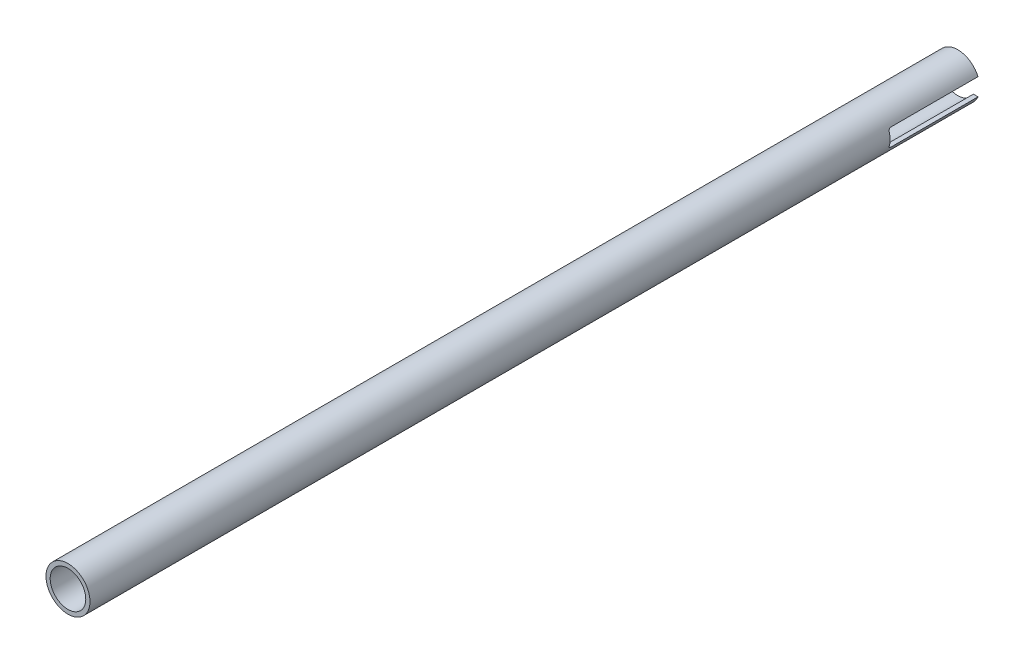
from build123d import *

# Parameters (mm, degrees)
SKETCH1_R               = 8.001
SKETCH1_R_2             = 6.477
BOSS_EXTRUDE1_DEPTH     = 323.85
CUT_EXTRUDE2_DEPTH      = 325.047611474
CUT_EXTRUDE2_DEPTH_BACK = 325.047611474


with BuildPart() as part:
    # Sketch1 → Boss-Extrude1 (new body)
    with BuildSketch(Plane.XY):
        Circle(SKETCH1_R)
        Circle(SKETCH1_R_2, mode=Mode.SUBTRACT)
    extrude(amount=BOSS_EXTRUDE1_DEPTH)

    # Sketch2 → Cut-Extrude2 (cut, two sides: drawn at the far end of the back side and taken through both)
    with BuildSketch(Plane(origin=(0, 0, 0), x_dir=(0, 0, -1), z_dir=(1, 0, 0)).offset(-CUT_EXTRUDE2_DEPTH_BACK)):
        with BuildLine():
            Line((658.085566807, 3.175), (0, 3.175))
            Line((0, 3.175), (-31.75, 3.175))
            ThreePointArc((-31.75, 3.175), (-32.378617928, 2.914617928), (-32.639, 2.286))
            Line((-32.639, 2.286), (-32.639, -2.286))
            ThreePointArc((-32.639, -2.286), (-32.378617928, -2.914617928), (-31.75, -3.175))
            Line((-31.75, -3.175), (0, -3.175))
            Line((0, -3.175), (658.085566807, -3.175))
            Line((658.085566807, -3.175), (1974.256700422, -3.175))
            Line((1974.256700422, -3.175), (1974.256700422, 3.175))
            Line((1974.256700422, 3.175), (658.085566807, 3.175))
        make_face()
    extrude(amount=CUT_EXTRUDE2_DEPTH + CUT_EXTRUDE2_DEPTH_BACK, mode=Mode.SUBTRACT)


solid = part.part
